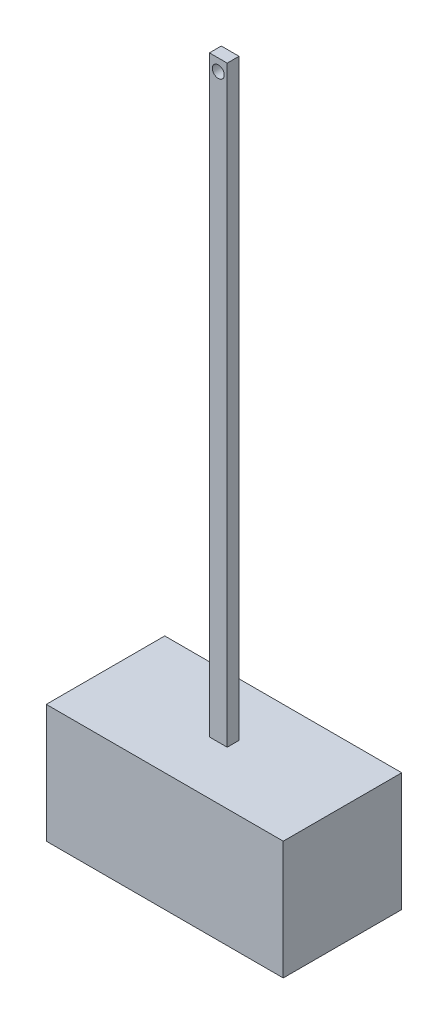
from build123d import *

# Parameters (mm, degrees)
SKETCH1_W           = 15
SKETCH1_H           = 500
SKETCH1_R           = 5
BOSS_EXTRUDE1_DEPTH = 10
SKETCH2_W           = 200
SKETCH2_H           = 100
BOSS_EXTRUDE2_DEPTH = 100


with BuildPart() as part:
    # Sketch1 → Boss-Extrude1 (new body)
    with BuildSketch(Plane.XY):
        with Locations((0, -240)):
            Rectangle(SKETCH1_W, SKETCH1_H)
        Circle(SKETCH1_R, mode=Mode.SUBTRACT)
    extrude(amount=BOSS_EXTRUDE1_DEPTH)

    # Sketch2 → Boss-Extrude2 (add)
    with BuildSketch(Plane.XZ.offset(490)):
        with Locations((-0.2, 5)):
            Rectangle(SKETCH2_W, SKETCH2_H)
    extrude(amount=BOSS_EXTRUDE2_DEPTH)


solid = part.part
